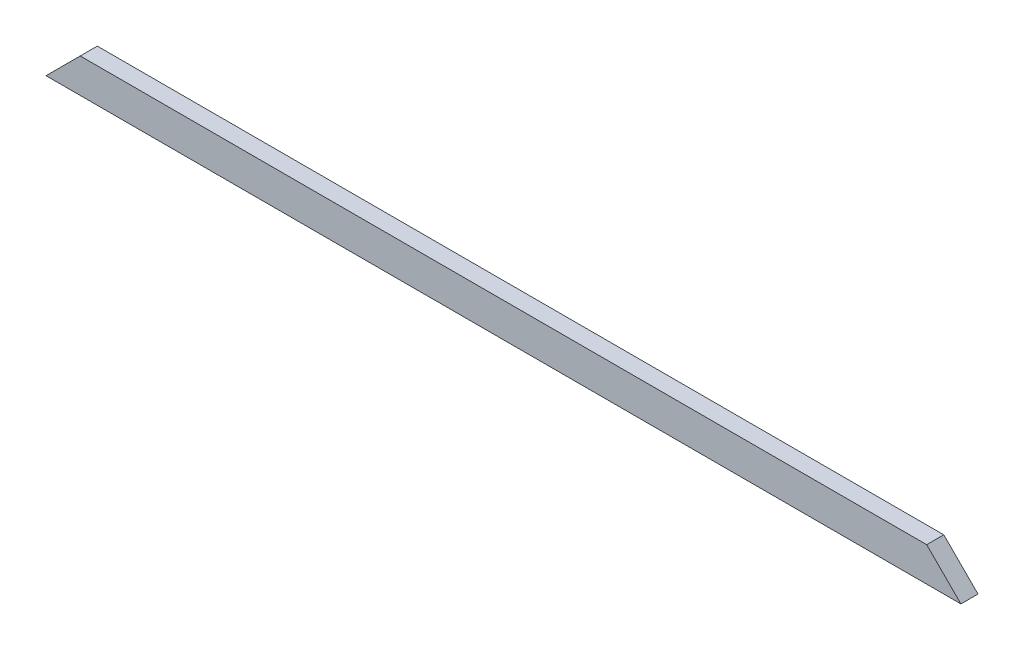
from build123d import *

# Parameters (mm, degrees)
BOSS_EXTRUDE1_DEPTH = 19.05


with BuildPart() as part:
    # Sketch1 → Boss-Extrude1 (new body)
    with BuildSketch(Plane.XY):
        Polygon((0, 0), (38.1, 38.1), (981.075, 38.1), (1019.175, 0), align=None)
    extrude(amount=BOSS_EXTRUDE1_DEPTH)


solid = part.part
